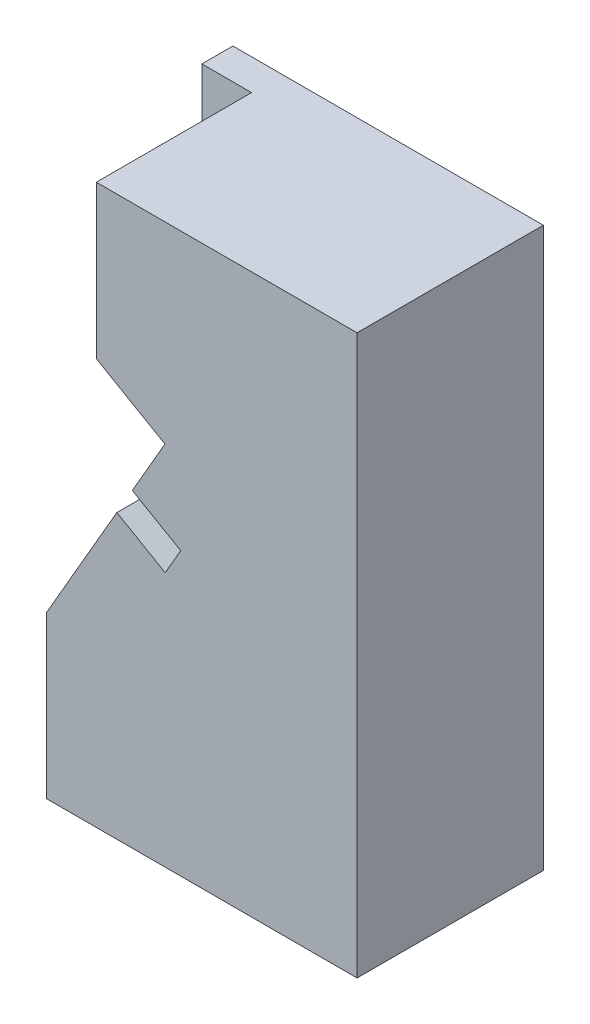
from build123d import *

# Parameters (mm, degrees)
SKETCH1_W           = 25
SKETCH1_H           = 15
BOSS_EXTRUDE2_DEPTH = 22.5
CUT_EXTRUDE2_DEPTH  = 12.5


with BuildPart() as part:
    # Sketch1 → Boss-Extrude2 (new, symmetric)
    with BuildSketch(Plane(origin=(0, 0, 0), x_dir=(1, 0, 0), z_dir=(0, 1, 0))):
        Rectangle(SKETCH1_W, SKETCH1_H)
    extrude(amount=BOSS_EXTRUDE2_DEPTH, both=True)

    # Sketch5 → Cut-Extrude2 (cut)
    with BuildSketch(Plane.XY.offset(7.5)):
        Polygon((-8.5, 10.190598923), (-2.973720558, 7), (-5.598720558, 2.45336663), (-1.701606241, 0.20336663), (-2.951606241, -1.961696879), (-6.848720558, 0.288303121), (-12.5, -9.5), (-12.5, 24.790598923), (-8.5, 24.790598923), align=None)
    extrude(amount=-CUT_EXTRUDE2_DEPTH, mode=Mode.SUBTRACT)


solid = part.part
